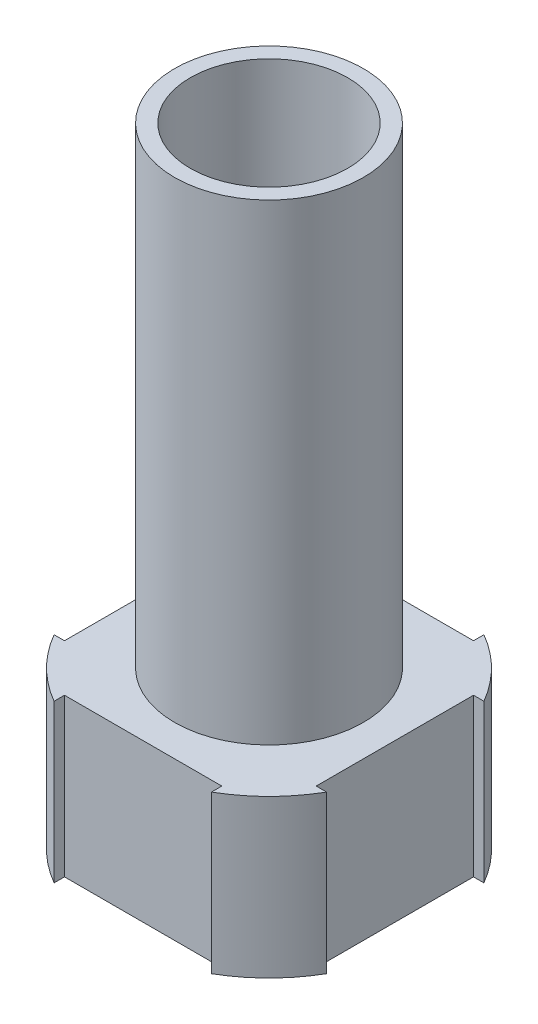
from build123d import *

# Parameters (mm, degrees)
SKETCH1_R           = 3
SKETCH1_R_2         = 2.5
BOSS_EXTRUDE1_DEPTH = 20
SKETCH1_3_R         = 5
SKETCH1_3_R_2       = 3
BOSS_EXTRUDE2_DEPTH = 5
SKETCH4_W           = 5
SKETCH4_H           = 5
CUT_EXTRUDE2_DEPTH  = 1
SKETCH5_W           = 5
SKETCH5_H           = 5
CUT_EXTRUDE3_DEPTH  = 1
SKETCH6_W           = 5
SKETCH6_H           = 5
CUT_EXTRUDE4_DEPTH  = 1
SKETCH7_W           = 5
SKETCH7_H           = 5
CUT_EXTRUDE5_DEPTH  = 1


with BuildPart() as part:
    # Sketch1 → Boss-Extrude1 (new body)
    with BuildSketch(Plane(origin=(0, 0, 0), x_dir=(1, 0, 0), z_dir=(0, 1, 0))):
        Circle(SKETCH1_R)
        Circle(SKETCH1_R_2, mode=Mode.SUBTRACT)
    extrude(amount=BOSS_EXTRUDE1_DEPTH)

    # Sketch1<3> → Boss-Extrude2 (add)
    with BuildSketch(Plane(origin=(0, 0, 0), x_dir=(1, 0, 0), z_dir=(0, 1, 0))):
        Circle(SKETCH1_3_R)
        Circle(SKETCH1_3_R_2, mode=Mode.SUBTRACT)
    extrude(amount=BOSS_EXTRUDE2_DEPTH)

    # Sketch4 → Cut-Extrude2 (cut)
    with BuildSketch(Plane.XY.offset(5)):
        with Locations((0, 2.5)):
            Rectangle(SKETCH4_W, SKETCH4_H)
    extrude(amount=-CUT_EXTRUDE2_DEPTH, mode=Mode.SUBTRACT)

    # Sketch5 → Cut-Extrude3 (cut)
    with BuildSketch(Plane.ZY.offset(5)):
        with Locations((0, 2.5)):
            Rectangle(SKETCH5_W, SKETCH5_H)
    extrude(amount=-CUT_EXTRUDE3_DEPTH, mode=Mode.SUBTRACT)

    # Sketch6 → Cut-Extrude4 (cut)
    with BuildSketch(Plane(origin=(0, 0, -5), x_dir=(-1, 0, 0), z_dir=(0, 0, -1))):
        with Locations((0, 2.5)):
            Rectangle(SKETCH6_W, SKETCH6_H)
    extrude(amount=-CUT_EXTRUDE4_DEPTH, mode=Mode.SUBTRACT)

    # Sketch7 → Cut-Extrude5 (cut)
    with BuildSketch(Plane(origin=(5, 0, 0), x_dir=(0, 0, -1), z_dir=(1, 0, 0))):
        with Locations((0, 2.5)):
            Rectangle(SKETCH7_W, SKETCH7_H)
    extrude(amount=-CUT_EXTRUDE5_DEPTH, mode=Mode.SUBTRACT)


solid = part.part
